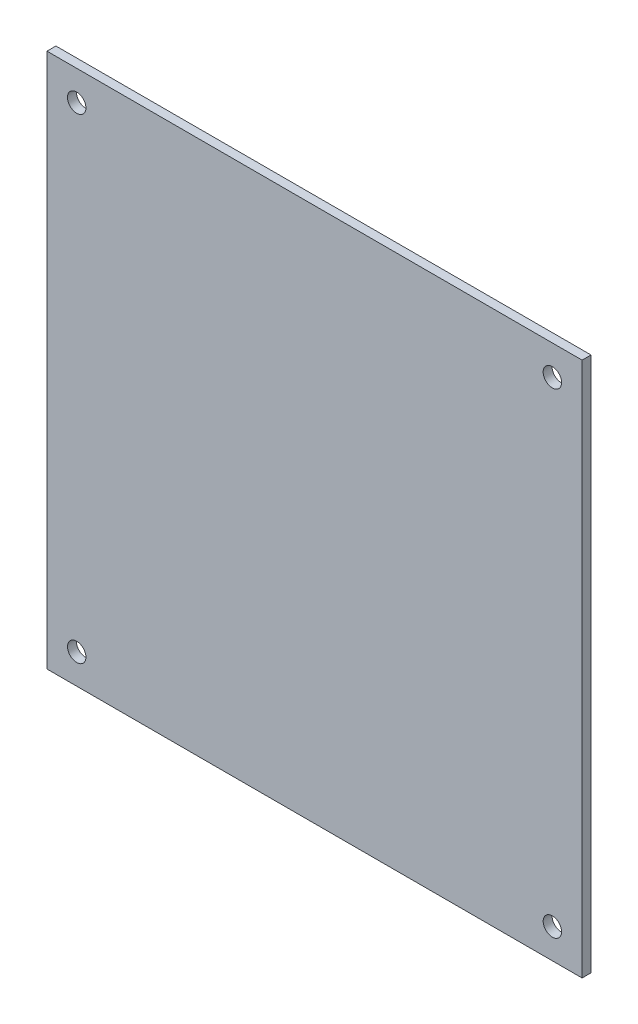
from build123d import *

# Parameters (mm, degrees)
SKETCH1_W                  = 90
SKETCH1_H                  = 90
BOSS_EXTRUDE1_DEPTH        = 1.5
F_3_1_3_1_DIAMETER_HOLE1_D = 3.1


with BuildPart() as part:
    # Sketch1 → Boss-Extrude1 (new body)
    with BuildSketch(Plane.XY):
        Rectangle(SKETCH1_W, SKETCH1_H)
    extrude(amount=BOSS_EXTRUDE1_DEPTH)

    # Ø3.1 (3.1) Diameter Hole1 (through all)
    with Locations(Plane.XY.offset(1.5)):
        with Locations((-40, 40), (40, 40), (40, -40), (-40, -40)):
            Hole(F_3_1_3_1_DIAMETER_HOLE1_D / 2)


solid = part.part
